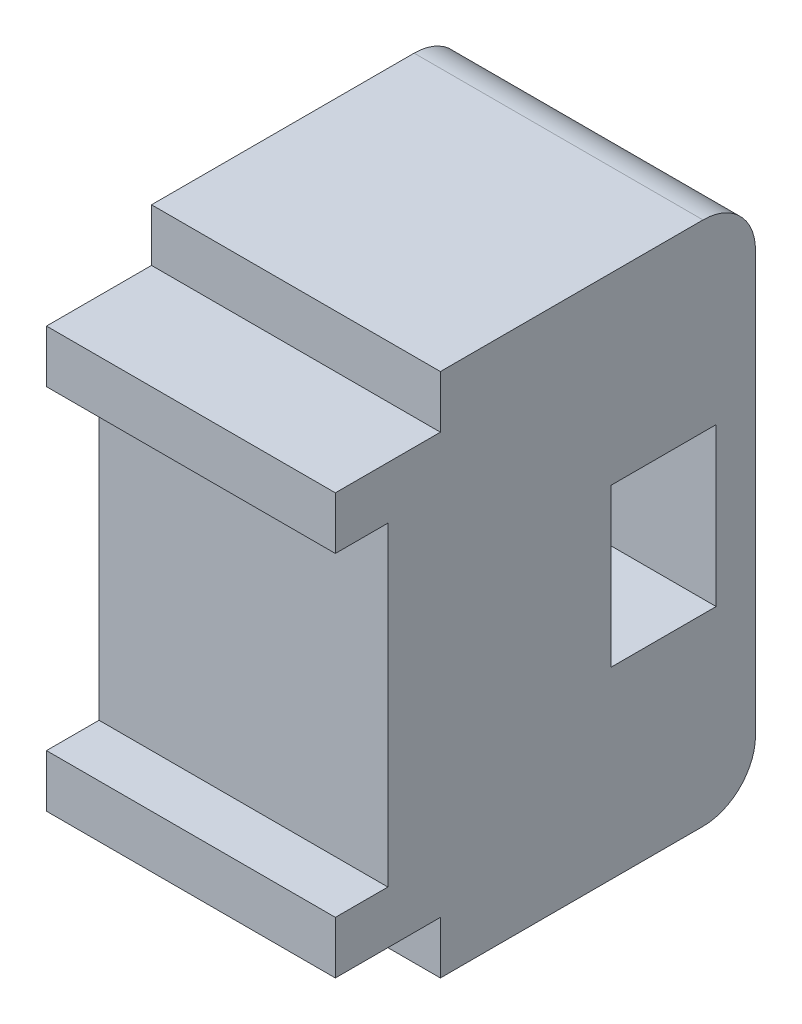
from build123d import *

# Parameters (mm, degrees)
SKETCH1_W           = 20
SKETCH1_H           = 12
BOSS_EXTRUDE1_DEPTH = 11
SKETCH5_W           = 16
SKETCH5_H           = 11
BOSS_EXTRUDE2_DEPTH = 8
FILLET1_R           = 2
SKETCH7_W           = 6
SKETCH7_H           = 4
CUT_EXTRUDE1_DEPTH  = 15
SKETCH9_W           = 11
SKETCH9_H           = 2
BOSS_EXTRUDE4_DEPTH = 2


with BuildPart() as part:
    # Sketch1 → Boss-Extrude1 (new body)
    with BuildSketch(Plane.YZ):
        Rectangle(SKETCH1_W, SKETCH1_H)
    extrude(amount=BOSS_EXTRUDE1_DEPTH)

    # Sketch5 → Boss-Extrude2 (add)
    with BuildSketch(Plane(origin=(0, 0, 0), x_dir=(0, 1, 0), z_dir=(0, 0, 1))):
        with Locations((0, -5.5)):
            Rectangle(SKETCH5_W, SKETCH5_H)
    extrude(amount=BOSS_EXTRUDE2_DEPTH)

    # Fillet1
    fillet1_edges = [part.edges().sort_by_distance(p)[0] for p in [
        (5.5, 10, -6),
        (5.5, -10, -6),
    ]]
    fillet(fillet1_edges, radius=FILLET1_R)

    # Sketch7 → Cut-Extrude1 (cut)
    with BuildSketch(Plane.YZ):
        with Locations((0, -2.5)):
            Rectangle(SKETCH7_W, SKETCH7_H)
    extrude(amount=CUT_EXTRUDE1_DEPTH, mode=Mode.SUBTRACT)

    # Sketch9 → Boss-Extrude4 (add)
    with BuildSketch(Plane.XY.offset(8)):
        with Locations((5.5, 7)):
            Rectangle(SKETCH9_W, SKETCH9_H)
        with Locations((5.5, -7)):
            Rectangle(SKETCH9_W, SKETCH9_H)
    extrude(amount=BOSS_EXTRUDE4_DEPTH)


solid = part.part
